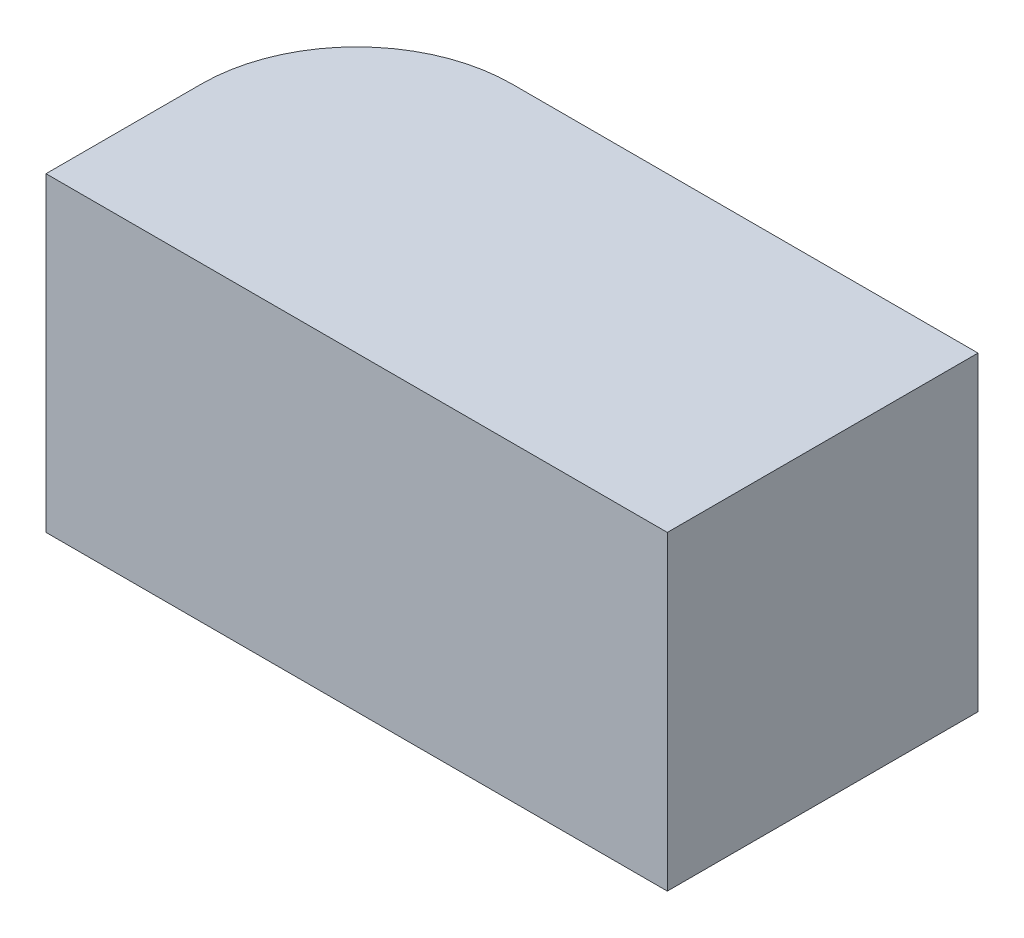
from build123d import *

# Parameters (mm, degrees)
BOSS_EXTRUDE1_DEPTH = 20


with BuildPart() as part:
    # Sketch1 → Boss-Extrude1 (new body)
    with BuildSketch(Plane(origin=(0, 0, 0), x_dir=(1, 0, 0), z_dir=(0, 1, 0))):
        with BuildLine():
            Line((0, 0), (30, 0))
            Line((30, 0), (30, -20))
            Line((30, -20), (-10, -20))
            Line((-10, -20), (-10, -10))
            ThreePointArc((-10, -10), (-7.071067812, -2.928932188), (0, 0))
        make_face()
    extrude(amount=BOSS_EXTRUDE1_DEPTH)


solid = part.part
